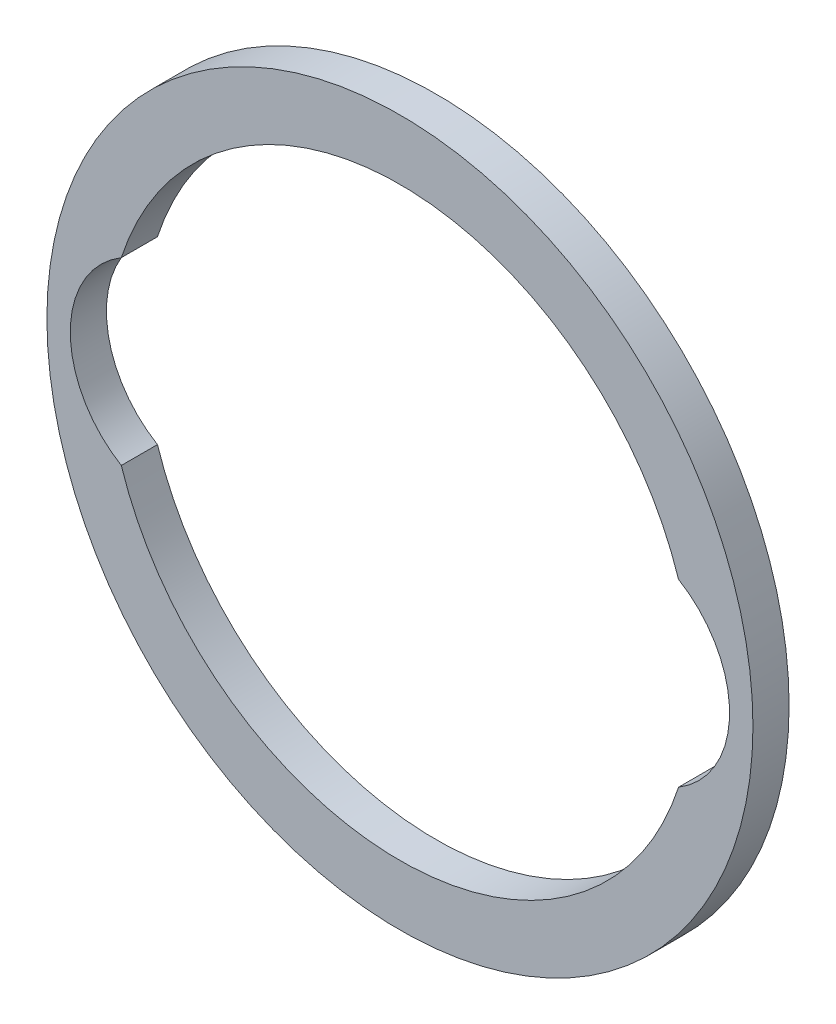
from build123d import *

# Parameters (mm, degrees)
P_IDAT_VYSUNUT_M1_DEPTH = 6


with BuildPart() as part:
    # Skica1 → Přidat vysunutím1 (new body)
    with BuildSketch(Plane.XY):
        with BuildLine():
            ThreePointArc((54.607141883, 21.260763283), (0, -58.6), (-54.607141883, 21.260763283))
            ThreePointArc((-54.607141883, 21.260763283), (0, 58.6), (54.607141883, 21.260763283))
        make_face()
        with BuildLine():
            ThreePointArc((-46.248555772, -14.934225425), (0, -48.6), (46.248555772, -14.934225425))
            ThreePointArc((46.248555772, -14.934225425), (54.72152315, 0.001816211), (46.247564334, 14.937295377))
            ThreePointArc((46.247564334, 14.937295377), (0, 48.6), (-46.247564334, 14.937295377))
            ThreePointArc((-46.247564334, 14.937295377), (-54.72152315, 0.001816211), (-46.248555772, -14.934225425))
        make_face(mode=Mode.SUBTRACT)
    extrude(amount=P_IDAT_VYSUNUT_M1_DEPTH)


solid = part.part
